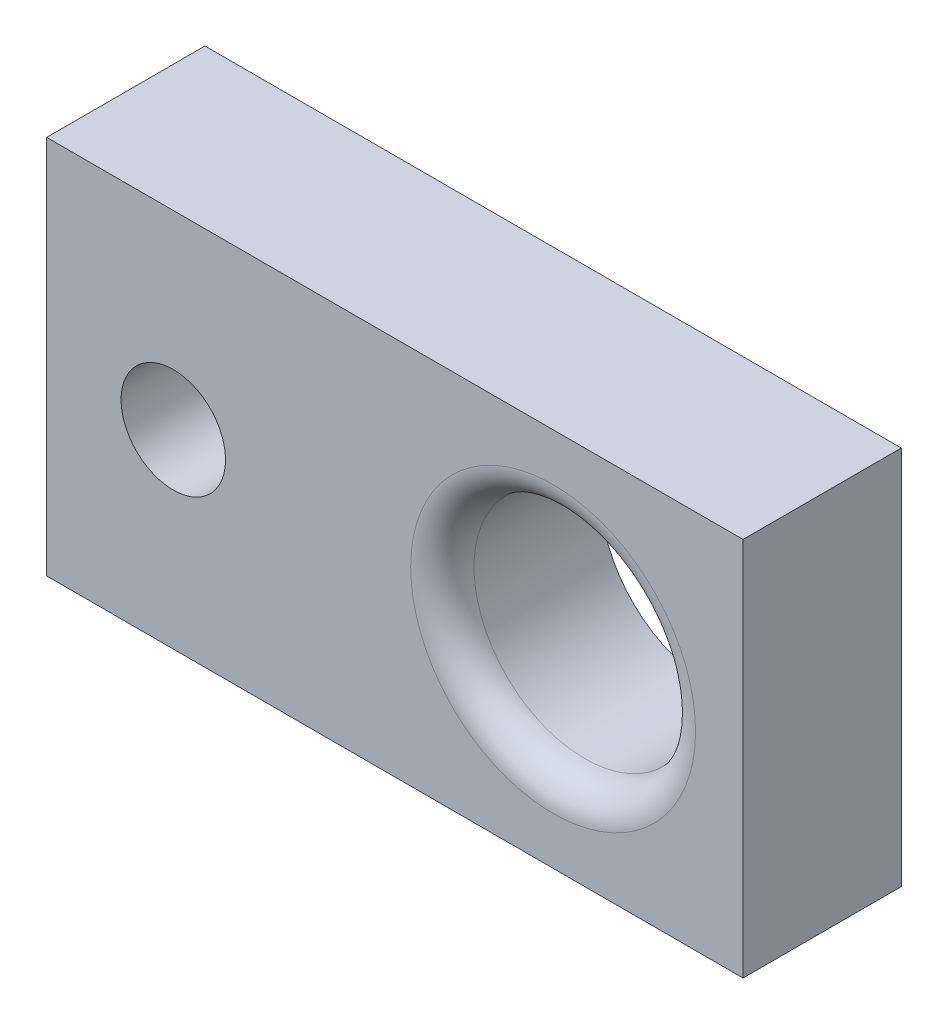
from build123d import *

# Parameters (mm, degrees)
ESBO_O1_W                                  = 22
ESBO_O1_H                                  = 12
RESSALTO_EXTRUS_O1_DEPTH                   = 5
BROCA_DE_ROSQUEAR_PARA_TARRAXA_DE_M8X1_0_D = 7
BROCA_DE_ROSQUEAR_PARA_TARRAXA_DE_M4X0_7_D = 3.3
FILETE1_R                                  = 1


with BuildPart() as part:
    # Esboço1 → Ressalto-extrusão1 (new body)
    with BuildSketch(Plane.XY):
        with Locations((-43.64943678, -9.559141583)):
            Rectangle(ESBO_O1_W, ESBO_O1_H)
    extrude(amount=RESSALTO_EXTRUS_O1_DEPTH)

    # Broca de rosquear para tarraxa de M8x1.01 (through all)
    with Locations(Plane.XY.offset(5)):
        with Locations((-38.64943678, -9.559141583)):
            Hole(BROCA_DE_ROSQUEAR_PARA_TARRAXA_DE_M8X1_0_D / 2)

    # Broca de rosquear para tarraxa de M4x0.71 (through all)
    with Locations(Plane.XY.offset(5)):
        with Locations((-50.64943678, -9.559141583)):
            Hole(BROCA_DE_ROSQUEAR_PARA_TARRAXA_DE_M4X0_7_D / 2)

    # Filete1
    filete1_edges = [part.edges().sort_by_distance(p)[0] for p in [
        (-35.14943678, -9.559141583, 5),
    ]]
    fillet(filete1_edges, radius=FILETE1_R)


solid = part.part
